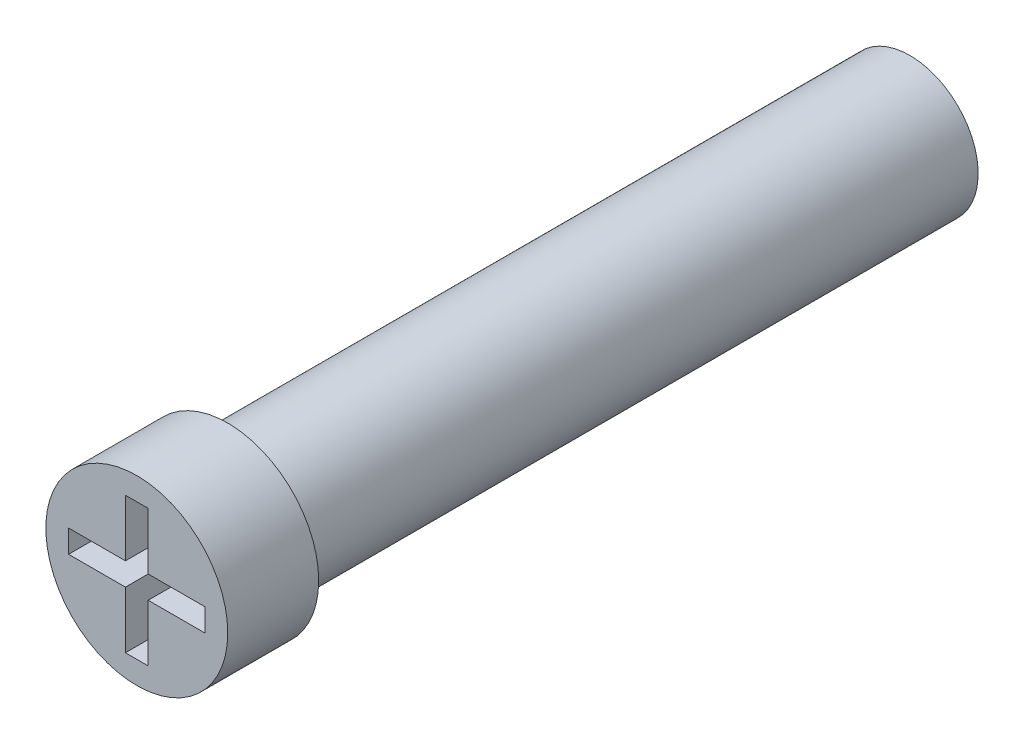
from build123d import *

# Parameters (mm, degrees)
SKETCH1_R           = 2
BOSS_EXTRUDE1_DEPTH = 2
SKETCH2_R           = 1.5
BOSS_EXTRUDE2_DEPTH = 15
SKETCH4_W           = 0.5
SKETCH4_H           = 1.25
SKETCH4_H_2         = 0.5
SKETCH4_W_2         = 1.25
CUT_EXTRUDE1_DEPTH  = 1


with BuildPart() as part:
    # Sketch1 → Boss-Extrude1 (new body)
    with BuildSketch(Plane.XY):
        Circle(SKETCH1_R)
    extrude(amount=BOSS_EXTRUDE1_DEPTH)

    # Sketch2 → Boss-Extrude2 (add)
    with BuildSketch(Plane(origin=(0, 0, 0), x_dir=(-1, 0, 0), z_dir=(0, 0, -1))):
        Circle(SKETCH2_R)
    extrude(amount=BOSS_EXTRUDE2_DEPTH)

    # Sketch4 → Cut-Extrude1 (cut)
    with BuildSketch(Plane.XY.offset(2)):
        with Locations((0, 0.875)):
            Rectangle(SKETCH4_W, SKETCH4_H)
        Rectangle(SKETCH4_W, SKETCH4_H_2)
        with Locations((0.875, 0)):
            Rectangle(SKETCH4_W_2, SKETCH4_H_2)
        with Locations((0, -0.875)):
            Rectangle(SKETCH4_W, SKETCH4_H)
        with Locations((-0.875, 0)):
            Rectangle(SKETCH4_W_2, SKETCH4_H_2)
    extrude(amount=-CUT_EXTRUDE1_DEPTH, mode=Mode.SUBTRACT)


solid = part.part
